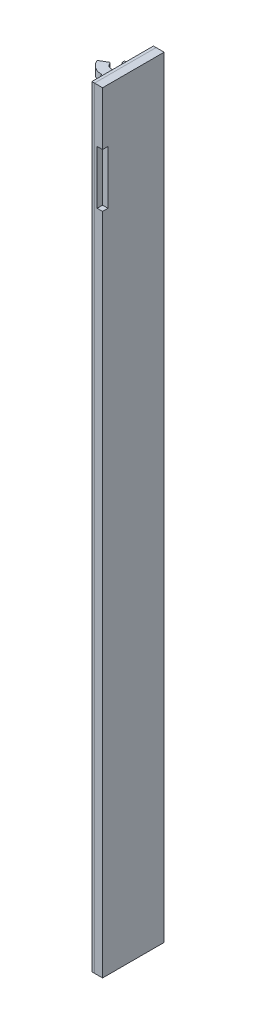
from build123d import *

# Parameters (mm, degrees)
SKETCH1_W             = 288
SKETCH1_H             = 23
BOSS_EXTRUDE1_DEPTH   = 1
BOSS_EXTRUDE5_START   = 1
SKETCH1_2_W           = 288
SKETCH1_2_H           = 23
BOSS_EXTRUDE5_DEPTH   = 3
BOSS_EXTRUDE2_DEPTH   = 2.8
BOSS_EXTRUDE3_START   = -270.5
BOSS_EXTRUDE3_DEPTH   = 2.8
CUT_EXTRUDE1_START    = -3
CUT_EXTRUDE1_DEPTH    = 1
BOSS_EXTRUDE4_START   = -3
BOSS_EXTRUDE4_DEPTH   = 1
BOSS_EXTRUDE4_2_DEPTH = 1
BOSS_EXTRUDE4_3_DEPTH = 1
BOSS_EXTRUDE4_4_DEPTH = 1
BOSS_EXTRUDE4_5_DEPTH = 1
BOSS_EXTRUDE4_6_DEPTH = 1
BOSS_EXTRUDE4_7_DEPTH = 1
BOSS_EXTRUDE4_8_DEPTH = 1
SKETCH6_W             = 20
SKETCH6_H             = 2
CUT_EXTRUDE2_DEPTH    = 2


with BuildPart() as part:
    # Sketch1 → Boss-Extrude1 (new body)
    with BuildSketch(Plane.YZ):
        Rectangle(SKETCH1_W, SKETCH1_H)
    extrude(amount=BOSS_EXTRUDE1_DEPTH)

    # Sketch3 → Boss-Extrude2 (add)
    with BuildSketch(Plane(origin=(0, 136.65, 0), x_dir=(0, 0, -1), z_dir=(0, 1, 0))):
        with BuildLine():
            Line((7.836067977, 7.9), (8.35, 7.9))
            ThreePointArc((8.35, 7.9), (8.526776695, 7.826776695), (8.6, 7.65))
            Line((8.6, 7.65), (8.6, 3.107106781))
            ThreePointArc((8.6, 3.107106781), (8.638060234, 2.915765065), (8.746446609, 2.753553391))
            Line((8.746446609, 2.753553391), (11.5, 0))
            Line((11.5, 0), (0, 0))
            Line((0, 0), (0, 4.56))
            ThreePointArc((0, 4.56), (-0.041005051, 4.658994949), (-0.14, 4.7))
            Line((-0.14, 4.7), (-0.36, 4.7))
            ThreePointArc((-0.36, 4.7), (-0.458994949, 4.741005051), (-0.5, 4.84))
            Line((-0.5, 4.84), (-0.5, 7.56))
            ThreePointArc((-0.5, 7.56), (-0.458994949, 7.658994949), (-0.36, 7.7))
            Line((-0.36, 7.7), (-0.14, 7.7))
            ThreePointArc((-0.14, 7.7), (-0.041005051, 7.741005051), (0, 7.84))
            Line((0, 7.84), (0, 7.9))
            ThreePointArc((0, 7.9), (0.750257739, 10.7), (2.8, 12.749742261))
            Line((2.8, 12.749742261), (3.449519053, 13.124742261))
            ThreePointArc((3.449519053, 13.124742261), (3.639223814, 13.149717367), (3.791025404, 13.03323591))
            Line((3.791025404, 13.03323591), (5.341025404, 10.348557159))
            ThreePointArc((5.341025404, 10.348557159), (5.366000509, 10.158852397), (5.249519053, 10.007050808))
            Line((5.249519053, 10.007050808), (4.6, 9.632050808))
            ThreePointArc((4.6, 9.632050808), (4.505174854, 6.226274246), (7.58761598, 7.677777778))
            ThreePointArc((7.58761598, 7.677777778), (7.669401311, 7.836338998), (7.836067977, 7.9))
        make_face()
    extrude(amount=-BOSS_EXTRUDE2_DEPTH)

    # Sketch3<2> → Boss-Extrude3 (add)
    with BuildSketch(Plane(origin=(0, 136.65, 0), x_dir=(0, 0, -1), z_dir=(0, 1, 0)).offset(BOSS_EXTRUDE3_START)):
        with BuildLine():
            Line((7.836067977, 7.9), (8.35, 7.9))
            ThreePointArc((8.35, 7.9), (8.526776695, 7.826776695), (8.6, 7.65))
            Line((8.6, 7.65), (8.6, 3.107106781))
            ThreePointArc((8.6, 3.107106781), (8.638060234, 2.915765065), (8.746446609, 2.753553391))
            Line((8.746446609, 2.753553391), (11.5, 0))
            Line((11.5, 0), (0, 0))
            Line((0, 0), (0, 4.56))
            ThreePointArc((0, 4.56), (-0.041005051, 4.658994949), (-0.14, 4.7))
            Line((-0.14, 4.7), (-0.36, 4.7))
            ThreePointArc((-0.36, 4.7), (-0.458994949, 4.741005051), (-0.5, 4.84))
            Line((-0.5, 4.84), (-0.5, 7.56))
            ThreePointArc((-0.5, 7.56), (-0.458994949, 7.658994949), (-0.36, 7.7))
            Line((-0.36, 7.7), (-0.14, 7.7))
            ThreePointArc((-0.14, 7.7), (-0.041005051, 7.741005051), (0, 7.84))
            Line((0, 7.84), (0, 7.9))
            ThreePointArc((0, 7.9), (0.750257739, 10.7), (2.8, 12.749742261))
            Line((2.8, 12.749742261), (3.449519053, 13.124742261))
            ThreePointArc((3.449519053, 13.124742261), (3.639223814, 13.149717367), (3.791025404, 13.03323591))
            Line((3.791025404, 13.03323591), (5.341025404, 10.348557159))
            ThreePointArc((5.341025404, 10.348557159), (5.366000509, 10.158852397), (5.249519053, 10.007050808))
            Line((5.249519053, 10.007050808), (4.6, 9.632050808))
            ThreePointArc((4.6, 9.632050808), (4.505174854, 6.226274246), (7.58761598, 7.677777778))
            ThreePointArc((7.58761598, 7.677777778), (7.669401311, 7.836338998), (7.836067977, 7.9))
        make_face()
    extrude(amount=-BOSS_EXTRUDE3_DEPTH)


with BuildPart() as body_2:
    # Sketch1<2> → Boss-Extrude5 (new body)
    with BuildSketch(Plane.YZ.offset(BOSS_EXTRUDE5_START)):
        Rectangle(SKETCH1_2_W, SKETCH1_2_H)
    extrude(amount=BOSS_EXTRUDE5_DEPTH)

    # Sketch4 → Cut-Extrude1 (cut)
    # profile 1 of 8: a face of its own
    with BuildSketch(Plane.YZ.offset(4).offset(CUT_EXTRUDE1_START)):
        Polygon((105.894557407, 6.823226802), (108.394557407, 4.323226802), (110.894557407, 6.823226802), align=None)
    # profile 2 of 8: a face of its own
    with BuildSketch(Plane.YZ.offset(4).offset(CUT_EXTRUDE1_START)):
        Polygon((-30, -5), (-29, -5), (-29, -0.5), (-10, -0.5), (-10, 5), (-30, 5), (-30, 4), (-11, 4), (-11, 0.5), (-30, 0.5), align=None)
    # profile 3 of 8: a face of its own
    with BuildSketch(Plane.YZ.offset(4).offset(CUT_EXTRUDE1_START)):
        Polygon((10, 5), (10, 4), (0.5, 4), (0.5, -5), (-10, -5), (-10, -4), (-0.5, -4), (-0.5, 5), align=None)
    # profile 4 of 8: a face of its own
    with BuildSketch(Plane.YZ.offset(4).offset(CUT_EXTRUDE1_START)):
        Polygon((29.945625464, 5), (32, 5), (23.027187268, 0), (32, -5), (29.945625464, -5), (22, -0.572388669), (14.054374536, -5), (12, -5), (20.972812732, 0), (12, 5), (14.054374536, 5), (22, 0.572388669), align=None)
    # profile 5 of 8: a face of its own
    with BuildSketch(Plane.YZ.offset(4).offset(CUT_EXTRUDE1_START)):
        with BuildLine():
            add(Edge.make_bspline(
                [(112.554813818, 5.558202763), (112.554990732, 5.589096731), (112.55533817, 5.649768497), (112.561358461, 5.738776255), (112.569293673, 5.824093515), (112.582216154, 5.905384691), (112.597417709, 5.983030256), (112.61643082, 6.05700716), (112.639334885, 6.127055969), (112.657555251, 6.171781377), (112.666492503, 6.19371959)],
                knots=[0, 0, 0, 0, 1.141009212, 2.240794809, 3.294380675, 4.305229195, 5.280013876, 6.216333343, 7.125095522, 8, 8, 8, 8], degree=3))
            add(Edge.make_bspline(
                [(112.666492503, 6.19371959), (112.68110152, 6.224907301), (112.710147726, 6.286915905), (112.764091096, 6.374539047), (112.825232726, 6.45717477), (112.893069253, 6.534389863), (112.965868789, 6.605021896), (113.043974769, 6.665472746), (113.124612321, 6.717783967), (113.181963928, 6.744093402), (113.210362696, 6.757121032)],
                knots=[0, 0, 0, 0, 1.031372299, 2.050613973, 3.077158538, 4.108712802, 5.127684358, 6.111366908, 7.06480644, 8, 8, 8, 8], degree=3))
            add(Edge.make_bspline(
                [(113.210362696, 6.757121032), (113.229639673, 6.765028018), (113.268603359, 6.781010053), (113.329157514, 6.80095647), (113.392009265, 6.817162032), (113.456704009, 6.831647916), (113.523869878, 6.84163641), (113.592964144, 6.850011419), (113.664364936, 6.854400907), (113.712661337, 6.854982511), (113.737205644, 6.855278084)],
                knots=[0, 0, 0, 0, 0.92659354, 1.872881803, 2.832850937, 3.813025581, 4.820167273, 5.851730198, 6.908245912, 8, 8, 8, 8], degree=3))
            add(Edge.make_bspline(
                [(113.737205644, 6.855278084), (113.781154127, 6.854176439), (113.867161911, 6.852020507), (113.992795131, 6.836448461), (114.111682302, 6.810153628), (114.22342099, 6.772147848), (114.32897457, 6.724639799), (114.427522955, 6.665711474), (114.519211997, 6.596000657), (114.603864605, 6.516463308), (114.680100341, 6.427238041), (114.746495334, 6.329158352), (114.802191757, 6.222683852), (114.848060977, 6.108108309), (114.883308016, 5.985057484), (114.908773969, 5.853878576), (114.923902807, 5.714474961), (114.925690551, 5.618837906), (114.926608689, 5.569721193)],
                knots=[0, 0, 0, 0, 1.064641025, 2.083517118, 3.061799897, 4.009540929, 4.938075217, 5.861300345, 6.78508344, 7.723570974, 8.670267188, 9.622657076, 10.586935816, 11.576069104, 12.607749008, 13.683335114, 14.81022093, 16, 16, 16, 16], degree=3))
            add(Edge.make_bspline(
                [(114.926608689, 5.569721193), (114.925711757, 5.520933371), (114.923965597, 5.425952598), (114.90855437, 5.287642889), (114.884144198, 5.157420279), (114.848044321, 5.035582243), (114.803544104, 4.921199076), (114.747274551, 4.815633172), (114.68227007, 4.71748427), (114.606142612, 4.629220475), (114.522914756, 4.549226661), (114.431342017, 4.480330588), (114.333511016, 4.421322418), (114.228532933, 4.373677078), (114.117091997, 4.336454014), (113.998824527, 4.309957124), (113.873669866, 4.294445002), (113.787997195, 4.292281241), (113.744216862, 4.291175519)],
                knots=[0, 0, 0, 0, 1.18845052, 2.313691126, 3.386664782, 4.412527756, 5.405809582, 6.372003093, 7.321919452, 8.268293321, 9.206237639, 10.129603466, 11.054616372, 11.9847576, 12.932764752, 13.912672021, 14.933336461, 16, 16, 16, 16], degree=3))
            add(Edge.make_bspline(
                [(113.744216862, 4.291175519), (113.699936443, 4.292283793), (113.613266942, 4.294453003), (113.48677739, 4.309917908), (113.367335914, 4.336423519), (113.255027566, 4.373777516), (113.149086384, 4.420699065), (113.05049048, 4.479104257), (112.959185354, 4.548436661), (112.875262081, 4.627488878), (112.799181696, 4.715493176), (112.734269512, 4.813011008), (112.677997024, 4.917545797), (112.633262848, 5.030680993), (112.59736176, 5.151252582), (112.572891939, 5.279954341), (112.557450912, 5.416432049), (112.555708916, 5.510082095), (112.554813818, 5.558202763)],
                knots=[0, 0, 0, 0, 1.080878253, 2.11558926, 3.1052859, 4.062802436, 5.000434901, 5.928596448, 6.853693179, 7.793554778, 8.738606028, 9.68692032, 10.647726704, 11.63151566, 12.651483354, 13.714466703, 14.825613081, 16, 16, 16, 16], degree=3))
        make_face()
        with BuildLine():
            add(Edge.make_bspline(
                [(113.035583048, 5.574729205), (113.036063331, 5.540147601), (113.036993389, 5.473180981), (113.046899736, 5.375980553), (113.061933415, 5.285111785), (113.084042648, 5.200677811), (113.111973456, 5.122617548), (113.146194486, 5.0508657), (113.186564315, 4.985315401), (113.234127113, 4.927350509), (113.285586331, 4.875599034), (113.341131965, 4.830820956), (113.399728842, 4.792280191), (113.462390863, 4.761852387), (113.527813922, 4.737704596), (113.596506309, 4.719799893), (113.668809579, 4.709968453), (113.718147323, 4.708558544), (113.74321526, 4.707842186)],
                knots=[0, 0, 0, 0, 1.313550922, 2.543666373, 3.708465049, 4.810029406, 5.85539231, 6.85404609, 7.825601258, 8.772642133, 9.696587791, 10.59409323, 11.479048685, 12.35559886, 13.234601248, 14.125357077, 15.047515647, 16, 16, 16, 16], degree=3))
            add(Edge.make_bspline(
                [(113.74321526, 4.707842186), (113.768286573, 4.70854403), (113.817630965, 4.709925372), (113.889845396, 4.719957829), (113.958673913, 4.737095098), (114.023837065, 4.761119146), (114.085631857, 4.792030106), (114.144004465, 4.829706868), (114.198618415, 4.874688667), (114.25002162, 4.925688322), (114.296300583, 4.984038211), (114.336326697, 5.049577198), (114.370530866, 5.121764223), (114.398464615, 5.20062629), (114.420029736, 5.286311777), (114.434449853, 5.378866021), (114.444436308, 5.478024381), (114.445362572, 5.546490653), (114.445839459, 5.581740423)],
                knots=[0, 0, 0, 0, 0.949153107, 1.868086493, 2.754172764, 3.630100905, 4.492260106, 5.365378617, 6.254840125, 7.166615376, 8.102436631, 9.067266169, 10.06813181, 11.121736829, 12.23011542, 13.408501285, 14.665770308, 16, 16, 16, 16], degree=3))
            add(Edge.make_bspline(
                [(114.445839459, 5.581740423), (114.44530081, 5.616649838), (114.444257665, 5.684255236), (114.435172951, 5.782161815), (114.420293868, 5.87324887), (114.399610299, 5.957492804), (114.372275663, 6.034907192), (114.339627639, 6.105703732), (114.300151541, 6.169512551), (114.254877294, 6.226300609), (114.204779255, 6.276285049), (114.150708572, 6.320044285), (114.092358036, 6.35645463), (114.030297137, 6.387088995), (113.963879758, 6.409816518), (113.893780854, 6.426393783), (113.819802051, 6.436602087), (113.769122873, 6.437931705), (113.74321526, 6.438611417)],
                knots=[0, 0, 0, 0, 1.332337092, 2.580197383, 3.749299508, 4.852775005, 5.886662144, 6.878700295, 7.822989687, 8.743523536, 9.644687758, 10.519443927, 11.392806431, 12.264866173, 13.155606721, 14.065961015, 15.011303331, 16, 16, 16, 16], degree=3))
            add(Edge.make_bspline(
                [(113.74321526, 6.438611417), (113.717304372, 6.437942161), (113.666618789, 6.436632995), (113.592524669, 6.426255677), (113.522204931, 6.410172373), (113.45579694, 6.386147105), (113.393195471, 6.355806927), (113.334632071, 6.318179059), (113.279645279, 6.274494086), (113.229098375, 6.223751767), (113.183090543, 6.166466423), (113.143595434, 6.101877926), (113.109917177, 6.030691662), (113.08228612, 5.952696913), (113.061802962, 5.867679121), (113.04605995, 5.776209658), (113.037219258, 5.677734895), (113.036140174, 5.609802391), (113.035583048, 5.574729205)],
                knots=[0, 0, 0, 0, 0.981996942, 1.920933313, 2.83127778, 3.712125466, 4.592427284, 5.463259035, 6.34592384, 7.249932058, 8.173122297, 9.125107726, 10.113123258, 11.154048744, 12.256187849, 13.424658091, 14.670364834, 16, 16, 16, 16], degree=3))
        make_face(mode=Mode.SUBTRACT)
    # profile 6 of 8: a face of its own
    with BuildSketch(Plane.YZ.offset(4).offset(CUT_EXTRUDE1_START)):
        with BuildLine():
            Line((115.343275356, 4.323226802), (115.343275356, 6.823226802))
            Line((115.343275356, 6.823226802), (116.143055003, 6.823226802))
            add(Edge.make_bspline(
                [(116.143055003, 6.823226802), (116.179280814, 6.823187241), (116.248566982, 6.823111577), (116.34739951, 6.821009321), (116.436383396, 6.818033345), (116.515386571, 6.814326893), (116.584687028, 6.808796155), (116.643973893, 6.802391643), (116.693620491, 6.795502088), (116.722855902, 6.78837232), (116.736003721, 6.785165904)],
                knots=[0, 0, 0, 0, 1.460485487, 2.793352117, 3.985295279, 5.050041172, 5.981765236, 6.787433016, 7.454681457, 8, 8, 8, 8], degree=3))
            add(Edge.make_bspline(
                [(116.736003721, 6.785165904), (116.753487124, 6.780180712), (116.788187582, 6.770286275), (116.837902517, 6.749192905), (116.885819842, 6.724746815), (116.931337528, 6.695611494), (116.974610302, 6.662304198), (117.015766792, 6.625096551), (117.055026479, 6.583820591), (117.091846256, 6.538557856), (117.12556884, 6.489536583), (117.154713625, 6.436684297), (117.179130862, 6.38023072), (117.199933942, 6.320600094), (117.215282553, 6.257153081), (117.226023791, 6.19033052), (117.233501032, 6.120103182), (117.234030444, 6.07204532), (117.234300997, 6.047485616)],
                knots=[0, 0, 0, 0, 0.907145743, 1.80047177, 2.69161667, 3.591261238, 4.495029544, 5.415863088, 6.359363025, 7.337192411, 8.326890979, 9.326929023, 10.346104993, 11.395420813, 12.477187422, 13.601053412, 14.774031606, 16, 16, 16, 16], degree=3))
            add(Edge.make_bspline(
                [(117.234300997, 6.047485616), (117.233529381, 6.010188912), (117.232043979, 5.938390709), (117.215424958, 5.835459283), (117.190076864, 5.74143806), (117.153028793, 5.657232661), (117.107859498, 5.58251265), (117.05810459, 5.515152912), (117.001291797, 5.45718374), (116.939910585, 5.407669616), (116.875041863, 5.367149311), (116.810055715, 5.332606326), (116.744075248, 5.306048576), (116.699089913, 5.294477151), (116.67690917, 5.288771673)],
                knots=[0, 0, 0, 0, 1.312386234, 2.526415563, 3.661883817, 4.733421185, 5.753802465, 6.732107337, 7.675884281, 8.604170108, 9.50284679, 10.365392406, 11.194030444, 12, 12, 12, 12], degree=3))
            add(Edge.make_bspline(
                [(116.67690917, 5.288771673), (116.661077644, 5.285760145), (116.627706675, 5.279412202), (116.574782315, 5.273084459), (116.516933121, 5.266080337), (116.453921156, 5.261511855), (116.385822647, 5.257233664), (116.312664038, 5.255213788), (116.23454988, 5.252780248), (116.180784444, 5.25273652), (116.153071029, 5.252713981)],
                knots=[0, 0, 0, 0, 0.735353946, 1.55003838, 2.431865514, 3.394945452, 4.432993119, 5.54609699, 6.735134699, 8, 8, 8, 8], degree=3))
            Line((116.153071029, 5.252713981), (115.824044587, 5.252713981))
            Line((115.824044587, 5.252713981), (115.824044587, 4.323226802))
            Line((115.824044587, 4.323226802), (115.343275356, 4.323226802))
        make_face()
        with BuildLine():
            Line((115.824044587, 6.406560135), (115.824044587, 5.669380648))
            Line((115.824044587, 5.669380648), (116.112506125, 5.669380648))
            add(Edge.make_bspline(
                [(116.112506125, 5.669380648), (116.13738144, 5.669412859), (116.184971048, 5.669474484), (116.253251578, 5.671686443), (116.315059178, 5.674386549), (116.370522994, 5.678855777), (116.419308231, 5.684746113), (116.461741591, 5.691791696), (116.497872531, 5.699352344), (116.536943223, 5.711881548), (116.578717605, 5.732152657), (116.623327735, 5.761287334), (116.662517681, 5.796121275), (116.695128911, 5.837032533), (116.721178064, 5.882487311), (116.739829276, 5.932019773), (116.751872347, 5.984808994), (116.752972371, 6.021377456), (116.753531766, 6.039973596)],
                knots=[0, 0, 0, 0, 1.411705958, 2.700771114, 3.876961699, 4.922619712, 5.858038221, 6.66485904, 7.363650596, 7.950905807, 8.989198271, 9.987739806, 10.967313358, 11.951275539, 12.944273208, 13.927870418, 14.946261014, 16, 16, 16, 16], degree=3))
            add(Edge.make_bspline(
                [(116.753531766, 6.039973596), (116.752744479, 6.062623406), (116.751218033, 6.106538399), (116.734385597, 6.169080679), (116.708415071, 6.225838556), (116.671284592, 6.275046037), (116.626431847, 6.316425482), (116.576019233, 6.350854651), (116.518970167, 6.374948446), (116.47859472, 6.384283902), (116.45805901, 6.38903209)],
                knots=[0, 0, 0, 0, 1.085904563, 2.105425768, 3.088705091, 4.068969419, 5.045188284, 6.010769642, 6.988240112, 8, 8, 8, 8], degree=3))
            add(Edge.make_bspline(
                [(116.45805901, 6.38903209), (116.449222025, 6.390445494), (116.429606657, 6.393582812), (116.397001924, 6.396856993), (116.358430521, 6.399834858), (116.313845951, 6.402279774), (116.263424939, 6.404191132), (116.207001173, 6.405865954), (116.144723254, 6.406000503), (116.101154222, 6.406368423), (116.078451638, 6.406560135)],
                knots=[0, 0, 0, 0, 0.564603001, 1.253243608, 2.066786758, 3.005752288, 4.070476343, 5.250658742, 6.567396469, 8, 8, 8, 8], degree=3))
            Line((116.078451638, 6.406560135), (115.824044587, 6.406560135))
        make_face(mode=Mode.SUBTRACT)
    # profile 7 of 8: a face of its own
    with BuildSketch(Plane.YZ.offset(4).offset(CUT_EXTRUDE1_START)):
        Polygon((117.650967664, 4.323226802), (117.650967664, 6.823226802), (119.509942023, 6.823226802), (119.509942023, 6.406560135), (118.131736894, 6.406560135), (118.131736894, 5.86168834), (119.413788176, 5.86168834), (119.413788176, 5.445021673), (118.131736894, 5.445021673), (118.131736894, 4.739893468), (119.541993305, 4.739893468), (119.541993305, 4.323226802), align=None)
    # profile 8 of 8: a face of its own
    with BuildSketch(Plane.YZ.offset(4).offset(CUT_EXTRUDE1_START)):
        Polygon((119.958659971, 4.323226802), (119.958659971, 6.823226802), (120.460963657, 6.823226802), (121.465070228, 5.179596994), (121.465070228, 6.823226802), (121.945839459, 6.823226802), (121.945839459, 4.323226802), (121.428010933, 4.323226802), (120.439429202, 5.940814943), (120.439429202, 4.323226802), align=None)
    extrude(amount=CUT_EXTRUDE1_DEPTH, mode=Mode.SUBTRACT)

    # Sketch6 → Cut-Extrude2 (cut)
    with BuildSketch(Plane.YZ.offset(4)):
        with Locations((114, 10.5)):
            Rectangle(SKETCH6_W, SKETCH6_H)
    extrude(amount=-CUT_EXTRUDE2_DEPTH, mode=Mode.SUBTRACT)


with BuildPart() as body_3:
    # Sketch4<2> → Boss-Extrude4 (new body)
    with BuildSketch(Plane.YZ.offset(4).offset(BOSS_EXTRUDE4_START)):
        Polygon((110.894557407, 6.823226802), (105.894557407, 6.823226802), (108.394557407, 4.323226802), align=None)
    extrude(amount=BOSS_EXTRUDE4_DEPTH)


with BuildPart() as body_4:
    # Sketch4<2> → Boss-Extrude4 2 (new body)
    with BuildSketch(Plane.YZ.offset(4).offset(BOSS_EXTRUDE4_START)):
        Polygon((-30, 0.5), (-30, -5), (-29, -5), (-29, -0.5), (-10, -0.5), (-10, 5), (-30, 5), (-30, 4), (-11, 4), (-11, 0.5), align=None)
    extrude(amount=BOSS_EXTRUDE4_2_DEPTH)


with BuildPart() as body_5:
    # Sketch4<2> → Boss-Extrude4 3 (new body)
    with BuildSketch(Plane.YZ.offset(4).offset(BOSS_EXTRUDE4_START)):
        Polygon((10, 4), (10, 5), (-0.5, 5), (-0.5, -4), (-10, -4), (-10, -5), (0.5, -5), (0.5, 4), align=None)
    extrude(amount=BOSS_EXTRUDE4_3_DEPTH)


with BuildPart() as body_6:
    # Sketch4<2> → Boss-Extrude4 4 (new body)
    with BuildSketch(Plane.YZ.offset(4).offset(BOSS_EXTRUDE4_START)):
        Polygon((32, 5), (29.945625464, 5), (22, 0.572388669), (14.054374536, 5), (12, 5), (20.972812732, 0), (12, -5), (14.054374536, -5), (22, -0.572388669), (29.945625464, -5), (32, -5), (23.027187268, 0), align=None)
    extrude(amount=BOSS_EXTRUDE4_4_DEPTH)


with BuildPart() as body_7:
    # Sketch4<2> → Boss-Extrude4 5 (new body)
    with BuildSketch(Plane.YZ.offset(4).offset(BOSS_EXTRUDE4_START)):
        with BuildLine():
            add(Edge.make_bspline(
                [(112.554813818, 5.558202763), (112.554990732, 5.589096731), (112.55533817, 5.649768497), (112.561358461, 5.738776255), (112.569293673, 5.824093515), (112.582216154, 5.905384691), (112.597417709, 5.983030256), (112.61643082, 6.05700716), (112.639334885, 6.127055969), (112.657555251, 6.171781377), (112.666492503, 6.19371959)],
                knots=[0, 0, 0, 0, 1.141009212, 2.240794809, 3.294380675, 4.305229195, 5.280013876, 6.216333343, 7.125095522, 8, 8, 8, 8], degree=3))
            add(Edge.make_bspline(
                [(113.744216862, 4.291175519), (113.699936443, 4.292283793), (113.613266942, 4.294453003), (113.48677739, 4.309917908), (113.367335914, 4.336423519), (113.255027566, 4.373777516), (113.149086384, 4.420699065), (113.05049048, 4.479104257), (112.959185354, 4.548436661), (112.875262081, 4.627488878), (112.799181696, 4.715493176), (112.734269512, 4.813011008), (112.677997024, 4.917545797), (112.633262848, 5.030680993), (112.59736176, 5.151252582), (112.572891939, 5.279954341), (112.557450912, 5.416432049), (112.555708916, 5.510082095), (112.554813818, 5.558202763)],
                knots=[0, 0, 0, 0, 1.080878253, 2.11558926, 3.1052859, 4.062802436, 5.000434901, 5.928596448, 6.853693179, 7.793554778, 8.738606028, 9.68692032, 10.647726704, 11.63151566, 12.651483354, 13.714466703, 14.825613081, 16, 16, 16, 16], degree=3))
            add(Edge.make_bspline(
                [(114.926608689, 5.569721193), (114.925711757, 5.520933371), (114.923965597, 5.425952598), (114.90855437, 5.287642889), (114.884144198, 5.157420279), (114.848044321, 5.035582243), (114.803544104, 4.921199076), (114.747274551, 4.815633172), (114.68227007, 4.71748427), (114.606142612, 4.629220475), (114.522914756, 4.549226661), (114.431342017, 4.480330588), (114.333511016, 4.421322418), (114.228532933, 4.373677078), (114.117091997, 4.336454014), (113.998824527, 4.309957124), (113.873669866, 4.294445002), (113.787997195, 4.292281241), (113.744216862, 4.291175519)],
                knots=[0, 0, 0, 0, 1.18845052, 2.313691126, 3.386664782, 4.412527756, 5.405809582, 6.372003093, 7.321919452, 8.268293321, 9.206237639, 10.129603466, 11.054616372, 11.9847576, 12.932764752, 13.912672021, 14.933336461, 16, 16, 16, 16], degree=3))
            add(Edge.make_bspline(
                [(113.737205644, 6.855278084), (113.781154127, 6.854176439), (113.867161911, 6.852020507), (113.992795131, 6.836448461), (114.111682302, 6.810153628), (114.22342099, 6.772147848), (114.32897457, 6.724639799), (114.427522955, 6.665711474), (114.519211997, 6.596000657), (114.603864605, 6.516463308), (114.680100341, 6.427238041), (114.746495334, 6.329158352), (114.802191757, 6.222683852), (114.848060977, 6.108108309), (114.883308016, 5.985057484), (114.908773969, 5.853878576), (114.923902807, 5.714474961), (114.925690551, 5.618837906), (114.926608689, 5.569721193)],
                knots=[0, 0, 0, 0, 1.064641025, 2.083517118, 3.061799897, 4.009540929, 4.938075217, 5.861300345, 6.78508344, 7.723570974, 8.670267188, 9.622657076, 10.586935816, 11.576069104, 12.607749008, 13.683335114, 14.81022093, 16, 16, 16, 16], degree=3))
            add(Edge.make_bspline(
                [(113.210362696, 6.757121032), (113.229639673, 6.765028018), (113.268603359, 6.781010053), (113.329157514, 6.80095647), (113.392009265, 6.817162032), (113.456704009, 6.831647916), (113.523869878, 6.84163641), (113.592964144, 6.850011419), (113.664364936, 6.854400907), (113.712661337, 6.854982511), (113.737205644, 6.855278084)],
                knots=[0, 0, 0, 0, 0.92659354, 1.872881803, 2.832850937, 3.813025581, 4.820167273, 5.851730198, 6.908245912, 8, 8, 8, 8], degree=3))
            add(Edge.make_bspline(
                [(112.666492503, 6.19371959), (112.68110152, 6.224907301), (112.710147726, 6.286915905), (112.764091096, 6.374539047), (112.825232726, 6.45717477), (112.893069253, 6.534389863), (112.965868789, 6.605021896), (113.043974769, 6.665472746), (113.124612321, 6.717783967), (113.181963928, 6.744093402), (113.210362696, 6.757121032)],
                knots=[0, 0, 0, 0, 1.031372299, 2.050613973, 3.077158538, 4.108712802, 5.127684358, 6.111366908, 7.06480644, 8, 8, 8, 8], degree=3))
        make_face()
        with BuildLine():
            add(Edge.make_bspline(
                [(113.035583048, 5.574729205), (113.036063331, 5.540147601), (113.036993389, 5.473180981), (113.046899736, 5.375980553), (113.061933415, 5.285111785), (113.084042648, 5.200677811), (113.111973456, 5.122617548), (113.146194486, 5.0508657), (113.186564315, 4.985315401), (113.234127113, 4.927350509), (113.285586331, 4.875599034), (113.341131965, 4.830820956), (113.399728842, 4.792280191), (113.462390863, 4.761852387), (113.527813922, 4.737704596), (113.596506309, 4.719799893), (113.668809579, 4.709968453), (113.718147323, 4.708558544), (113.74321526, 4.707842186)],
                knots=[0, 0, 0, 0, 1.313550922, 2.543666373, 3.708465049, 4.810029406, 5.85539231, 6.85404609, 7.825601258, 8.772642133, 9.696587791, 10.59409323, 11.479048685, 12.35559886, 13.234601248, 14.125357077, 15.047515647, 16, 16, 16, 16], degree=3))
            add(Edge.make_bspline(
                [(113.74321526, 6.438611417), (113.717304372, 6.437942161), (113.666618789, 6.436632995), (113.592524669, 6.426255677), (113.522204931, 6.410172373), (113.45579694, 6.386147105), (113.393195471, 6.355806927), (113.334632071, 6.318179059), (113.279645279, 6.274494086), (113.229098375, 6.223751767), (113.183090543, 6.166466423), (113.143595434, 6.101877926), (113.109917177, 6.030691662), (113.08228612, 5.952696913), (113.061802962, 5.867679121), (113.04605995, 5.776209658), (113.037219258, 5.677734895), (113.036140174, 5.609802391), (113.035583048, 5.574729205)],
                knots=[0, 0, 0, 0, 0.981996942, 1.920933313, 2.83127778, 3.712125466, 4.592427284, 5.463259035, 6.34592384, 7.249932058, 8.173122297, 9.125107726, 10.113123258, 11.154048744, 12.256187849, 13.424658091, 14.670364834, 16, 16, 16, 16], degree=3))
            add(Edge.make_bspline(
                [(114.445839459, 5.581740423), (114.44530081, 5.616649838), (114.444257665, 5.684255236), (114.435172951, 5.782161815), (114.420293868, 5.87324887), (114.399610299, 5.957492804), (114.372275663, 6.034907192), (114.339627639, 6.105703732), (114.300151541, 6.169512551), (114.254877294, 6.226300609), (114.204779255, 6.276285049), (114.150708572, 6.320044285), (114.092358036, 6.35645463), (114.030297137, 6.387088995), (113.963879758, 6.409816518), (113.893780854, 6.426393783), (113.819802051, 6.436602087), (113.769122873, 6.437931705), (113.74321526, 6.438611417)],
                knots=[0, 0, 0, 0, 1.332337092, 2.580197383, 3.749299508, 4.852775005, 5.886662144, 6.878700295, 7.822989687, 8.743523536, 9.644687758, 10.519443927, 11.392806431, 12.264866173, 13.155606721, 14.065961015, 15.011303331, 16, 16, 16, 16], degree=3))
            add(Edge.make_bspline(
                [(113.74321526, 4.707842186), (113.768286573, 4.70854403), (113.817630965, 4.709925372), (113.889845396, 4.719957829), (113.958673913, 4.737095098), (114.023837065, 4.761119146), (114.085631857, 4.792030106), (114.144004465, 4.829706868), (114.198618415, 4.874688667), (114.25002162, 4.925688322), (114.296300583, 4.984038211), (114.336326697, 5.049577198), (114.370530866, 5.121764223), (114.398464615, 5.20062629), (114.420029736, 5.286311777), (114.434449853, 5.378866021), (114.444436308, 5.478024381), (114.445362572, 5.546490653), (114.445839459, 5.581740423)],
                knots=[0, 0, 0, 0, 0.949153107, 1.868086493, 2.754172764, 3.630100905, 4.492260106, 5.365378617, 6.254840125, 7.166615376, 8.102436631, 9.067266169, 10.06813181, 11.121736829, 12.23011542, 13.408501285, 14.665770308, 16, 16, 16, 16], degree=3))
        make_face(mode=Mode.SUBTRACT)
    extrude(amount=BOSS_EXTRUDE4_5_DEPTH)


with BuildPart() as body_8:
    # Sketch4<2> → Boss-Extrude4 6 (new body)
    with BuildSketch(Plane.YZ.offset(4).offset(BOSS_EXTRUDE4_START)):
        with BuildLine():
            Line((115.343275356, 6.823226802), (115.343275356, 4.323226802))
            Line((115.343275356, 4.323226802), (115.824044587, 4.323226802))
            Line((115.824044587, 4.323226802), (115.824044587, 5.252713981))
            Line((115.824044587, 5.252713981), (116.153071029, 5.252713981))
            add(Edge.make_bspline(
                [(116.67690917, 5.288771673), (116.661077644, 5.285760145), (116.627706675, 5.279412202), (116.574782315, 5.273084459), (116.516933121, 5.266080337), (116.453921156, 5.261511855), (116.385822647, 5.257233664), (116.312664038, 5.255213788), (116.23454988, 5.252780248), (116.180784444, 5.25273652), (116.153071029, 5.252713981)],
                knots=[0, 0, 0, 0, 0.735353946, 1.55003838, 2.431865514, 3.394945452, 4.432993119, 5.54609699, 6.735134699, 8, 8, 8, 8], degree=3))
            add(Edge.make_bspline(
                [(117.234300997, 6.047485616), (117.233529381, 6.010188912), (117.232043979, 5.938390709), (117.215424958, 5.835459283), (117.190076864, 5.74143806), (117.153028793, 5.657232661), (117.107859498, 5.58251265), (117.05810459, 5.515152912), (117.001291797, 5.45718374), (116.939910585, 5.407669616), (116.875041863, 5.367149311), (116.810055715, 5.332606326), (116.744075248, 5.306048576), (116.699089913, 5.294477151), (116.67690917, 5.288771673)],
                knots=[0, 0, 0, 0, 1.312386234, 2.526415563, 3.661883817, 4.733421185, 5.753802465, 6.732107337, 7.675884281, 8.604170108, 9.50284679, 10.365392406, 11.194030444, 12, 12, 12, 12], degree=3))
            add(Edge.make_bspline(
                [(116.736003721, 6.785165904), (116.753487124, 6.780180712), (116.788187582, 6.770286275), (116.837902517, 6.749192905), (116.885819842, 6.724746815), (116.931337528, 6.695611494), (116.974610302, 6.662304198), (117.015766792, 6.625096551), (117.055026479, 6.583820591), (117.091846256, 6.538557856), (117.12556884, 6.489536583), (117.154713625, 6.436684297), (117.179130862, 6.38023072), (117.199933942, 6.320600094), (117.215282553, 6.257153081), (117.226023791, 6.19033052), (117.233501032, 6.120103182), (117.234030444, 6.07204532), (117.234300997, 6.047485616)],
                knots=[0, 0, 0, 0, 0.907145743, 1.80047177, 2.69161667, 3.591261238, 4.495029544, 5.415863088, 6.359363025, 7.337192411, 8.326890979, 9.326929023, 10.346104993, 11.395420813, 12.477187422, 13.601053412, 14.774031606, 16, 16, 16, 16], degree=3))
            add(Edge.make_bspline(
                [(116.143055003, 6.823226802), (116.179280814, 6.823187241), (116.248566982, 6.823111577), (116.34739951, 6.821009321), (116.436383396, 6.818033345), (116.515386571, 6.814326893), (116.584687028, 6.808796155), (116.643973893, 6.802391643), (116.693620491, 6.795502088), (116.722855902, 6.78837232), (116.736003721, 6.785165904)],
                knots=[0, 0, 0, 0, 1.460485487, 2.793352117, 3.985295279, 5.050041172, 5.981765236, 6.787433016, 7.454681457, 8, 8, 8, 8], degree=3))
            Line((116.143055003, 6.823226802), (115.343275356, 6.823226802))
        make_face()
        with BuildLine():
            Line((115.824044587, 5.669380648), (115.824044587, 6.406560135))
            Line((115.824044587, 6.406560135), (116.078451638, 6.406560135))
            add(Edge.make_bspline(
                [(116.45805901, 6.38903209), (116.449222025, 6.390445494), (116.429606657, 6.393582812), (116.397001924, 6.396856993), (116.358430521, 6.399834858), (116.313845951, 6.402279774), (116.263424939, 6.404191132), (116.207001173, 6.405865954), (116.144723254, 6.406000503), (116.101154222, 6.406368423), (116.078451638, 6.406560135)],
                knots=[0, 0, 0, 0, 0.564603001, 1.253243608, 2.066786758, 3.005752288, 4.070476343, 5.250658742, 6.567396469, 8, 8, 8, 8], degree=3))
            add(Edge.make_bspline(
                [(116.753531766, 6.039973596), (116.752744479, 6.062623406), (116.751218033, 6.106538399), (116.734385597, 6.169080679), (116.708415071, 6.225838556), (116.671284592, 6.275046037), (116.626431847, 6.316425482), (116.576019233, 6.350854651), (116.518970167, 6.374948446), (116.47859472, 6.384283902), (116.45805901, 6.38903209)],
                knots=[0, 0, 0, 0, 1.085904563, 2.105425768, 3.088705091, 4.068969419, 5.045188284, 6.010769642, 6.988240112, 8, 8, 8, 8], degree=3))
            add(Edge.make_bspline(
                [(116.112506125, 5.669380648), (116.13738144, 5.669412859), (116.184971048, 5.669474484), (116.253251578, 5.671686443), (116.315059178, 5.674386549), (116.370522994, 5.678855777), (116.419308231, 5.684746113), (116.461741591, 5.691791696), (116.497872531, 5.699352344), (116.536943223, 5.711881548), (116.578717605, 5.732152657), (116.623327735, 5.761287334), (116.662517681, 5.796121275), (116.695128911, 5.837032533), (116.721178064, 5.882487311), (116.739829276, 5.932019773), (116.751872347, 5.984808994), (116.752972371, 6.021377456), (116.753531766, 6.039973596)],
                knots=[0, 0, 0, 0, 1.411705958, 2.700771114, 3.876961699, 4.922619712, 5.858038221, 6.66485904, 7.363650596, 7.950905807, 8.989198271, 9.987739806, 10.967313358, 11.951275539, 12.944273208, 13.927870418, 14.946261014, 16, 16, 16, 16], degree=3))
            Line((116.112506125, 5.669380648), (115.824044587, 5.669380648))
        make_face(mode=Mode.SUBTRACT)
    extrude(amount=BOSS_EXTRUDE4_6_DEPTH)


with BuildPart() as body_9:
    # Sketch4<2> → Boss-Extrude4 7 (new body)
    with BuildSketch(Plane.YZ.offset(4).offset(BOSS_EXTRUDE4_START)):
        Polygon((117.650967664, 6.823226802), (117.650967664, 4.323226802), (119.541993305, 4.323226802), (119.541993305, 4.739893468), (118.131736894, 4.739893468), (118.131736894, 5.445021673), (119.413788176, 5.445021673), (119.413788176, 5.86168834), (118.131736894, 5.86168834), (118.131736894, 6.406560135), (119.509942023, 6.406560135), (119.509942023, 6.823226802), align=None)
    extrude(amount=BOSS_EXTRUDE4_7_DEPTH)


with BuildPart() as body_10:
    # Sketch4<2> → Boss-Extrude4 8 (new body)
    with BuildSketch(Plane.YZ.offset(4).offset(BOSS_EXTRUDE4_START)):
        Polygon((119.958659971, 6.823226802), (119.958659971, 4.323226802), (120.439429202, 4.323226802), (120.439429202, 5.940814943), (121.428010933, 4.323226802), (121.945839459, 4.323226802), (121.945839459, 6.823226802), (121.465070228, 6.823226802), (121.465070228, 5.179596994), (120.460963657, 6.823226802), align=None)
    extrude(amount=BOSS_EXTRUDE4_8_DEPTH)


solid = Compound([part.part, body_2.part, body_3.part, body_4.part, body_5.part, body_6.part, body_7.part, body_8.part, body_9.part, body_10.part])
